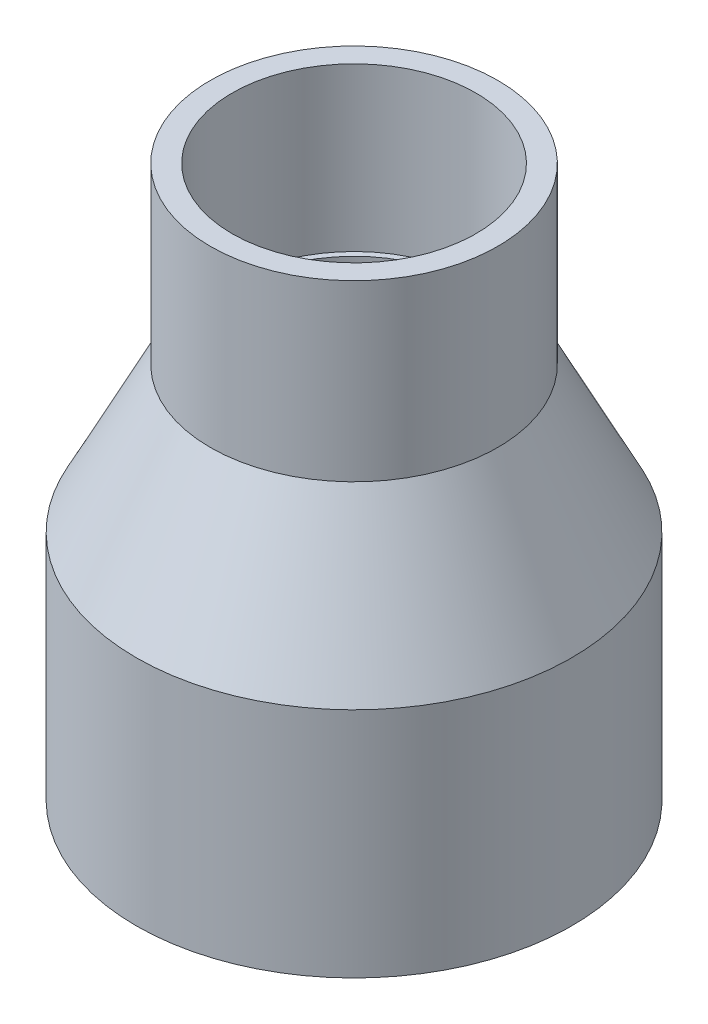
from build123d import *

# Parameters (mm, degrees)
SKETCH1_R           = 37.5
BOSS_EXTRUDE1_DEPTH = 65
CHAMFER1_SIZE       = 25
CHAMFER1_SIZE2      = 12.738136237
SKETCH3_R           = 21
CUT_EXTRUDE1_DEPTH  = 30
SKETCH4_R           = 35
CUT_EXTRUDE2_DEPTH  = 39
SKETCH5_R           = 24.761863763
BOSS_EXTRUDE3_DEPTH = 30
SKETCH6_R           = 21
CUT_EXTRUDE3_DEPTH  = 28
SKETCH7_R           = 20
CUT_EXTRUDE4_DEPTH  = 30


with BuildPart() as part:
    # Sketch1 → Boss-Extrude1 (new body)
    with BuildSketch(Plane(origin=(0, 0, 0), x_dir=(1, 0, 0), z_dir=(0, 1, 0))):
        with Locations(Location((0, 0, 0), (0, 0, 270))):
            Circle(SKETCH1_R)
    extrude(amount=BOSS_EXTRUDE1_DEPTH)

    # Chamfer1
    chamfer1_edges = [part.edges().sort_by_distance(p)[0] for p in [
        (0, 65, -37.5),
    ]]
    chamfer1_side = [part.faces().sort_by_distance(p)[0] for p in [
        (0, 32.5, -37.5),
    ]]
    chamfer(chamfer1_edges, length=CHAMFER1_SIZE, length2=CHAMFER1_SIZE2, reference=chamfer1_side[0])

    # Sketch3 → Cut-Extrude1 (cut)
    with BuildSketch(Plane(origin=(0, 65, 0), x_dir=(1, 0, 0), z_dir=(0, 1, 0))):
        with Locations(Location((0, 0, 0), (0, 0, 270))):
            Circle(SKETCH3_R)
    extrude(amount=-CUT_EXTRUDE1_DEPTH, mode=Mode.SUBTRACT)

    # Sketch4 → Cut-Extrude2 (cut)
    with BuildSketch(Plane.XZ):
        with Locations(Location((0, 0, 0), (0, 0, 270))):
            Circle(SKETCH4_R)
    extrude(amount=-CUT_EXTRUDE2_DEPTH, mode=Mode.SUBTRACT)

    # Sketch5 → Boss-Extrude3 (add)
    with BuildSketch(Plane(origin=(0, 65, 0), x_dir=(1, 0, 0), z_dir=(0, 1, 0))):
        with Locations(Location((0, 0, 0), (0, 0, 270))):
            Circle(SKETCH5_R)
    extrude(amount=BOSS_EXTRUDE3_DEPTH)

    # Sketch6 → Cut-Extrude3 (cut)
    with BuildSketch(Plane(origin=(0, 95, 0), x_dir=(1, 0, 0), z_dir=(0, 1, 0))):
        with Locations(Location((0, 0, 0), (0, 0, 270))):
            Circle(SKETCH6_R)
    extrude(amount=-CUT_EXTRUDE3_DEPTH, mode=Mode.SUBTRACT)

    # Sketch7 → Cut-Extrude4 (cut)
    with BuildSketch(Plane(origin=(0, 67, 0), x_dir=(1, 0, 0), z_dir=(0, 1, 0))):
        with Locations(Location((0, 0, 0), (0, 0, 270))):
            Circle(SKETCH7_R)
    extrude(amount=-CUT_EXTRUDE4_DEPTH, mode=Mode.SUBTRACT)


solid = part.part
